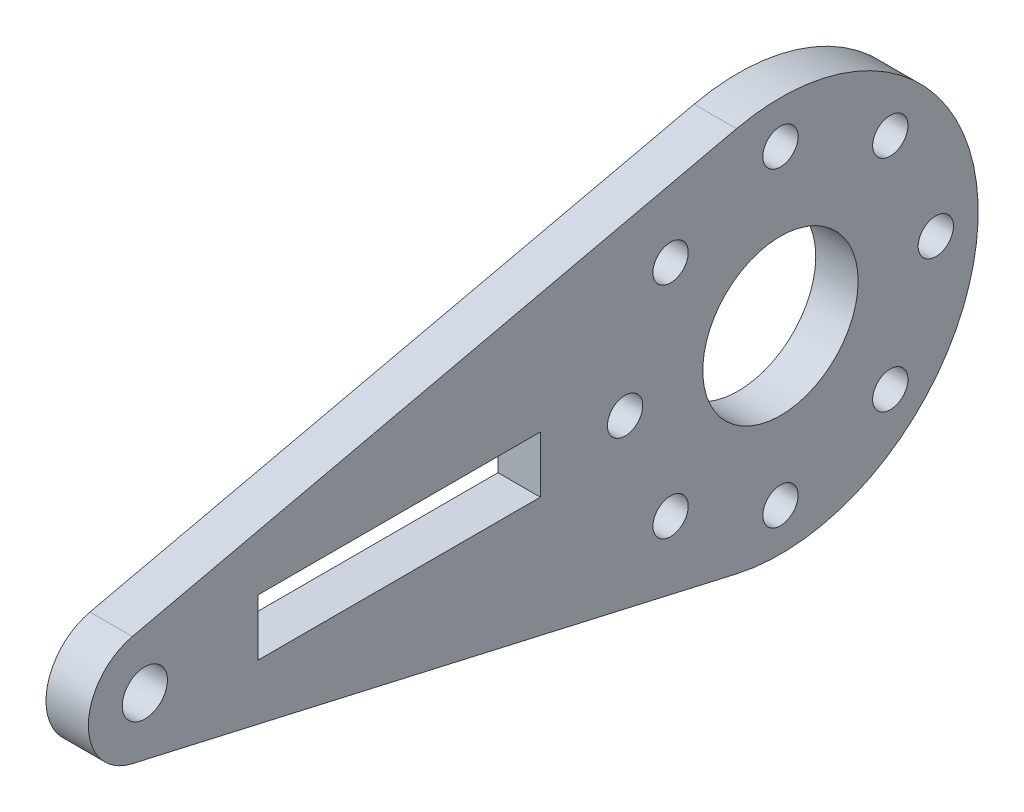
from build123d import *

# Parameters (mm, degrees)
SKETCH1_R           = 1.6
SKETCH1_R_2         = 5.5
SKETCH1_W           = 20
SKETCH1_H           = 4
BOSS_EXTRUDE1_DEPTH = 3
CUT_EXTRUDE1_REACH  = 53.049
SKETCH2_R           = 1.25
CIRPATTERN1_COUNT   = 8


with BuildPart() as part:
    # Sketch1 → Boss-Extrude1 (new body)
    with BuildSketch(Plane(origin=(0, 0, 0), x_dir=(0, 0, -1), z_dir=(1, 0, 0))):
        with BuildLine():
            Line((-45.888888889, 3.899984172), (-3.111111111, 13.649944603))
            ThreePointArc((-3.111111111, 13.649944603), (14, 0), (-3.111111111, -13.649944603))
            Line((-3.111111111, -13.649944603), (-45.888888889, -3.899984172))
            ThreePointArc((-45.888888889, -3.899984172), (-49, 0), (-45.888888889, 3.899984172))
        make_face()
        with Locations((-45, 0)):
            Circle(SKETCH1_R, mode=Mode.SUBTRACT)
        Circle(SKETCH1_R_2, mode=Mode.SUBTRACT)
        with Locations((-27, 0)):
            Rectangle(SKETCH1_W, SKETCH1_H, mode=Mode.SUBTRACT)
    extrude(amount=BOSS_EXTRUDE1_DEPTH)

    # Sketch2 → Cut-Extrude1 (cut, up to next)
    with BuildSketch(Plane(origin=(3, 0, 0), x_dir=(0, 0, -1), z_dir=(1, 0, 0)), mode=Mode.PRIVATE) as cut_extrude1_sk1:
        with Locations((0, 11)):
            Circle(SKETCH2_R)
    cut_extrude1_tool1 = extrude(cut_extrude1_sk1.sketch, amount=-CUT_EXTRUDE1_REACH, mode=Mode.PRIVATE) & part.part
    cut_extrude1 = cut_extrude1_tool1.solids().sort_by_distance((3, 11, 0))[0]
    add(cut_extrude1, mode=Mode.SUBTRACT)

    # CirPattern1: Cut-Extrude1 ×8 about axis
    cirpattern1_axis = Axis((0, 0, 0), (1, 0, 0))
    for i in range(1, CIRPATTERN1_COUNT):
        add(cut_extrude1.rotate(cirpattern1_axis, i * 360 / CIRPATTERN1_COUNT), mode=Mode.SUBTRACT)


solid = part.part
